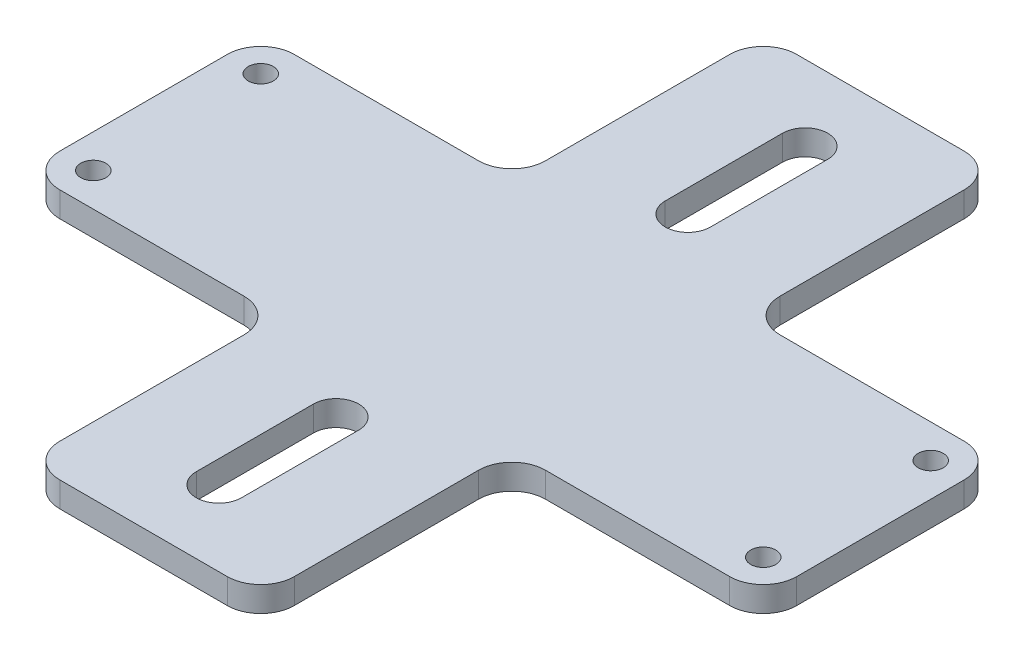
from build123d import *

# Parameters (mm, degrees)
SKETCH_1_R          = 1.5
EXTRUDE_1_DEPTH     = 5
CUT_EXTRUDE_1_DEPTH = 10
SKETCH_3_W          = 97.68283175
SKETCH_3_H          = 2
CUT_EXTRUDE_2_DEPTH = 94


with BuildPart() as part:
    # 草图1 → 凸台-拉伸1 (new body)
    with BuildSketch(Plane(origin=(0, 0, 0), x_dir=(1, 0, 0), z_dir=(0, 1, 0))):
        with BuildLine():
            Line((14, -40), (14, -18))
            ThreePointArc((14, -18), (15.171572875, -15.171572875), (18, -14))
            Line((18, -14), (40, -14))
            ThreePointArc((40, -14), (42.828427125, -12.828427125), (44, -10))
            Line((44, -10), (44, 10))
            ThreePointArc((44, 10), (42.828427125, 12.828427125), (40, 14))
            Line((40, 14), (18, 14))
            ThreePointArc((18, 14), (15.171572875, 15.171572875), (14, 18))
            Line((14, 18), (14, 40))
            ThreePointArc((14, 40), (12.828427125, 42.828427125), (10, 44))
            Line((10, 44), (-10, 44))
            ThreePointArc((-10, 44), (-12.828427125, 42.828427125), (-14, 40))
            Line((-14, 40), (-14, 18))
            ThreePointArc((-14, 18), (-15.171572875, 15.171572875), (-18, 14))
            Line((-18, 14), (-40, 14))
            ThreePointArc((-40, 14), (-42.828427125, 12.828427125), (-44, 10))
            Line((-44, 10), (-44, -10))
            ThreePointArc((-44, -10), (-42.828427125, -12.828427125), (-40, -14))
            Line((-40, -14), (-18, -14))
            ThreePointArc((-18, -14), (-15.171572875, -15.171572875), (-14, -18))
            Line((-14, -18), (-14, -40))
            ThreePointArc((-14, -40), (-12.828427125, -42.828427125), (-10, -44))
            Line((-10, -44), (10, -44))
            ThreePointArc((10, -44), (12.828427125, -42.828427125), (14, -40))
        make_face()
        with Locations(Location((40, 10, 0), (0, 0, 270))):
            Circle(SKETCH_1_R, mode=Mode.SUBTRACT)
        with Locations(Location((40, -10, 0), (0, 0, 270))):
            Circle(SKETCH_1_R, mode=Mode.SUBTRACT)
        with Locations(Location((-40, 10, 0), (0, 0, 270))):
            Circle(SKETCH_1_R, mode=Mode.SUBTRACT)
        with Locations(Location((-40, -10, 0), (0, 0, 270))):
            Circle(SKETCH_1_R, mode=Mode.SUBTRACT)
        with BuildLine():
            ThreePointArc((-2.7, 30), (0, 27.3), (2.7, 30))
            Line((2.7, 30), (2.7, 35))
            ThreePointArc((2.7, 35), (0, 37.7), (-2.7, 35))
            Line((-2.7, 35), (-2.7, 30))
        make_face(mode=Mode.SUBTRACT)
        with BuildLine():
            ThreePointArc((2.7, -30), (0, -27.3), (-2.7, -30))
            Line((-2.7, -30), (-2.7, -35))
            ThreePointArc((-2.7, -35), (0, -37.7), (2.7, -35))
            Line((2.7, -35), (2.7, -30))
        make_face(mode=Mode.SUBTRACT)
    extrude(amount=EXTRUDE_1_DEPTH)

    # 草图2 → 切除-拉伸1 (cut)
    with BuildSketch(Plane.XZ):
        with BuildLine():
            Line((-2.7, -21), (-2.7, -30))
            ThreePointArc((-2.7, -30), (0, -27.3), (2.7, -30))
            Line((2.7, -30), (2.7, -21))
            ThreePointArc((2.7, -21), (0, -18.3), (-2.7, -21))
        make_face()
        with BuildLine():
            ThreePointArc((2.7, 30), (0, 27.3), (-2.7, 30))
            Line((-2.7, 30), (-2.7, 21))
            ThreePointArc((-2.7, 21), (0, 18.3), (2.7, 21))
            Line((2.7, 21), (2.7, 30))
        make_face()
        with BuildLine():
            ThreePointArc((-2.7, -30), (0, -27.3), (2.7, -30))
            Line((2.7, -30), (2.7, -35))
            ThreePointArc((2.7, -35), (0, -37.7), (-2.7, -35))
            Line((-2.7, -35), (-2.7, -30))
        make_face()
        with BuildLine():
            ThreePointArc((2.7, 30), (0, 27.3), (-2.7, 30))
            Line((-2.7, 30), (-2.7, 35))
            ThreePointArc((-2.7, 35), (0, 37.7), (2.7, 35))
            Line((2.7, 35), (2.7, 30))
        make_face()
    extrude(amount=-CUT_EXTRUDE_1_DEPTH, mode=Mode.SUBTRACT)

    # 草图3 → 切除-拉伸2 (cut)
    with BuildSketch(Plane.XY.offset(44)):
        with Locations((4.841415875, 4)):
            Rectangle(SKETCH_3_W, SKETCH_3_H)
    extrude(amount=-CUT_EXTRUDE_2_DEPTH, mode=Mode.SUBTRACT)


solid = part.part
